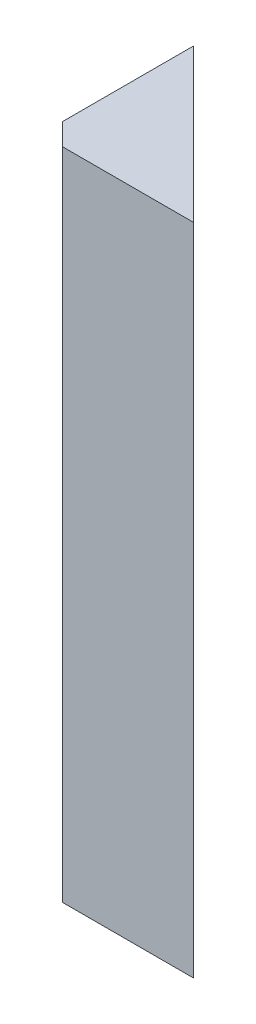
from build123d import *

# Parameters (mm, degrees)
BOSS_EXTRUDE1_DEPTH = 1.5


with BuildPart() as part:
    # Sketch1 → Boss-Extrude1 (new body)
    with BuildSketch(Plane(origin=(0, 0, 0), x_dir=(1, 0, 0), z_dir=(0, 1, 0))):
        Polygon((0, 0), (0, 0.3), (0.35, -0.05), (0.05, -0.05), align=None)
    extrude(amount=BOSS_EXTRUDE1_DEPTH)


solid = part.part
